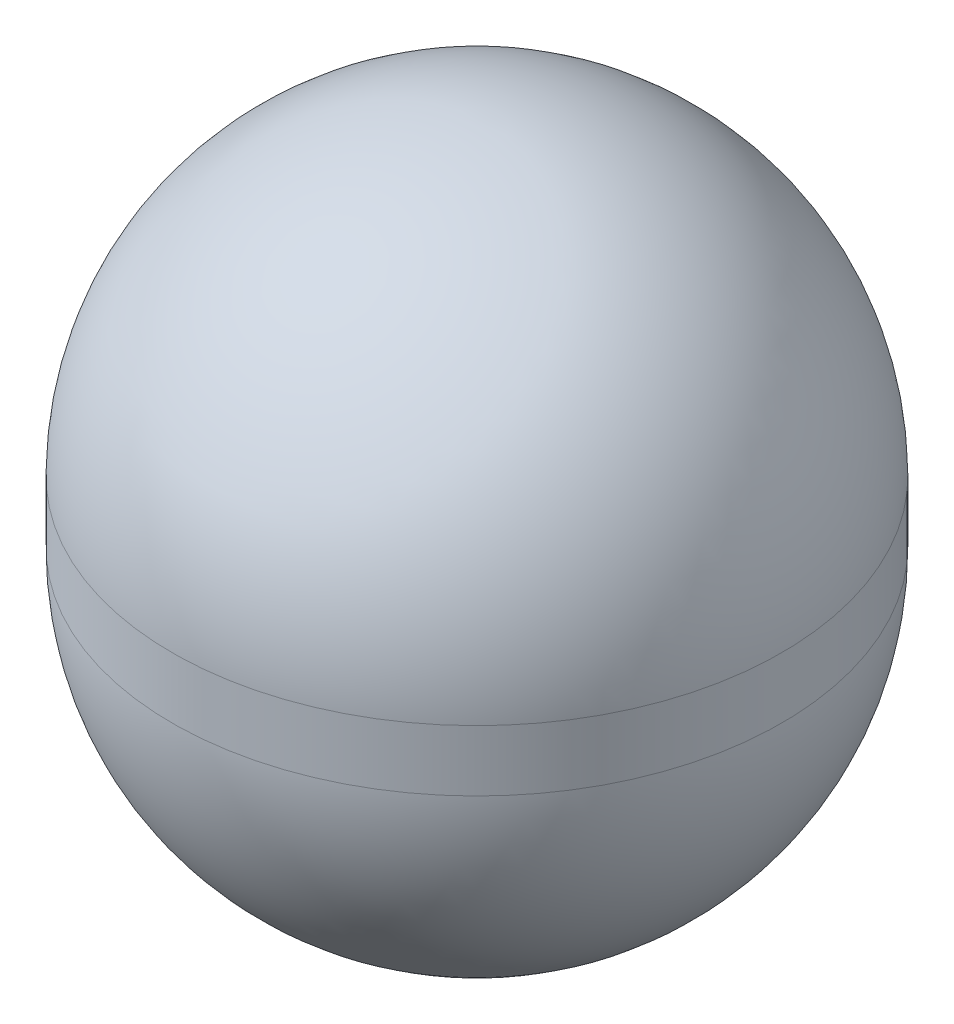
from build123d import *

# Parameters (mm, degrees)
REVOLVE2_ANGLE      = 180
SKETCH2_R           = 12.7
BOSS_EXTRUDE1_DEPTH = 2.54
REVOLVE3_ANGLE      = 180


with BuildPart() as part:
    # Sketch1 → Revolve2 (revolve)
    with BuildSketch(Plane(origin=(0, 0, 0), x_dir=(1, 0, 0), z_dir=(0, 1, 0))):
        with BuildLine():
            Line((0, -12.7), (0, 12.7))
            ThreePointArc((0, 12.7), (12.7, 0), (0, -12.7))
        make_face()
    revolve(axis=Axis((0, 0, 12.7), (0, 0, -1)), revolution_arc=REVOLVE2_ANGLE)

    # Sketch2 → Boss-Extrude1 (add)
    with BuildSketch(Plane(origin=(0, 0, 0), x_dir=(1, 0, 0), z_dir=(0, 1, 0))):
        with Locations(Location((0, 0, 0), (0, 0, 180))):
            Circle(SKETCH2_R)
    extrude(amount=BOSS_EXTRUDE1_DEPTH)

    # Sketch3 → Revolve3 (revolve)
    with BuildSketch(Plane(origin=(0, 2.54, 0), x_dir=(1, 0, 0), z_dir=(0, 1, 0))):
        with BuildLine():
            Line((0, 12.7), (0, -12.7))
            ThreePointArc((0, -12.7), (12.7, 0), (0, 12.7))
        make_face()
    revolve(axis=Axis((0, 2.54, -12.7), (0, 0, 1)), revolution_arc=REVOLVE3_ANGLE)


solid = part.part
